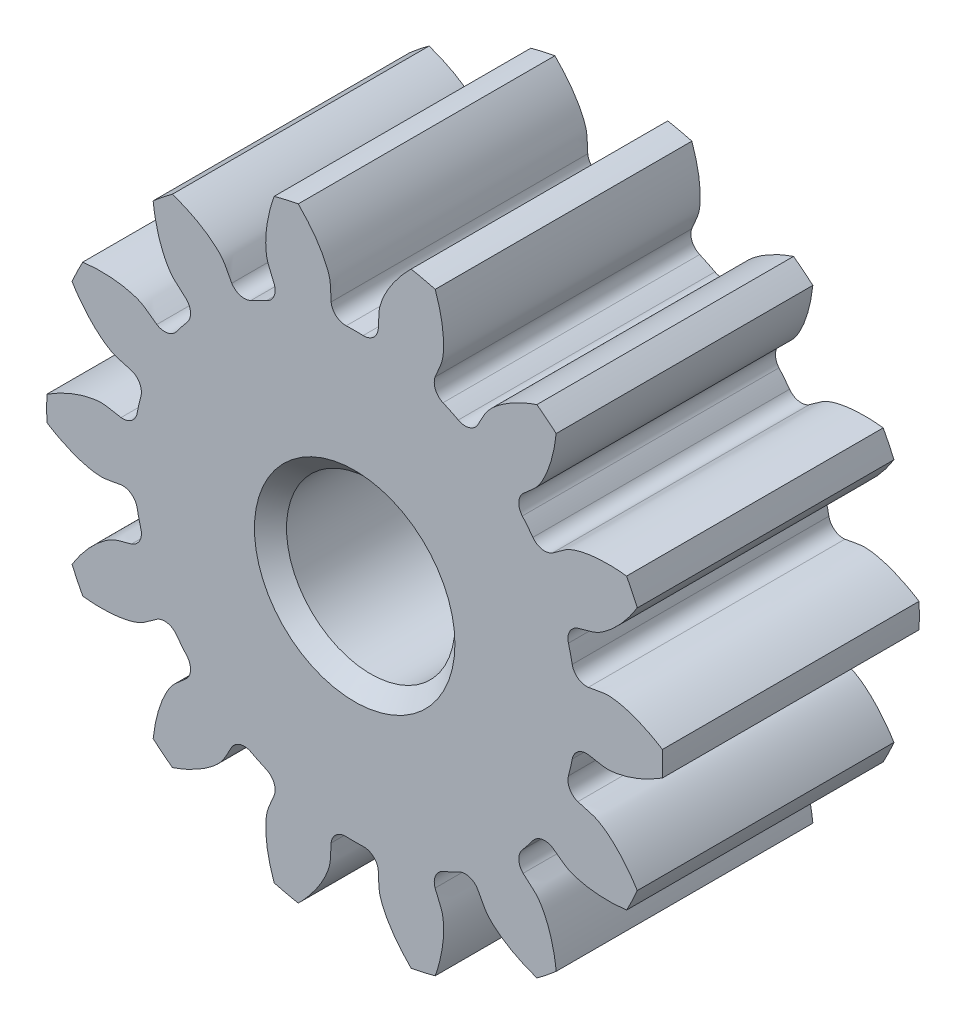
from build123d import *

# Parameters (mm, degrees)
SKETCH1_R           = 9.6
LASHENA_DEPTH       = 8
CUT_EXTRUDEA_DEPTH  = 8
WWW_KYTOOL_CN_COUNT = 14
SKETCH3_R           = 2.625
CUT_EXTRUDE2_DEPTH  = 16.659700927
CHAMFER1_SIZE       = 0.5


with BuildPart() as part:
    # Sketch1 → LaShenA (new body)
    with BuildSketch(Plane.XY):
        Circle(SKETCH1_R)
    extrude(amount=LASHENA_DEPTH)

    # SketchA → Cut-ExtrudeA (cut)
    with BuildSketch(Plane.XY.offset(8)):
        with BuildLine():
            ThreePointArc((0.26393016, 6.894950389), (0, 6.9), (-0.26393016, 6.894950389))
            ThreePointArc((-0.26393016, 6.894950389), (-0.579770413, 7.005805588), (-0.734822357, 7.302458305))
            add(Edge.make_bspline(
                [(-0.734822357, 7.302458305), (-0.754433399, 7.487112064), (-0.737569189, 7.703882298), (-0.781720243, 7.928445907), (-0.797392974, 7.985498549), (-0.811085013, 8.030575138), (-0.828493419, 8.082070174), (-0.849959168, 8.139814633), (-0.875893686, 8.203596808), (-0.906673874, 8.273194995), (-0.942675165, 8.348367366), (-0.984260087, 8.428855678), (-1.031780916, 8.514384646), (-1.085577958, 8.604662703), (-1.145979199, 8.699382364), (-1.213299565, 8.798220744), (-1.287840319, 8.90084006), (-1.369888442, 9.006888177), (-1.459716048, 9.11599916), (-1.557579813, 9.227793861), (-1.663720428, 9.341880521), (-1.778362068, 9.457855399), (-1.90171193, 9.575303407), (-2.033959602, 9.693798799), (-2.226077653, 9.855722018), (-2.3785632, 9.972613701), (-2.48435509, 10.048922054)],
                knots=[0.117633248, 0.117633248, 0.117633248, 0.117633248, 0.261739633, 0.285267442, 0.295625886, 0.307867683, 0.321992833, 0.338001336, 0.355893192, 0.375668402, 0.397326964, 0.42086888, 0.446294149, 0.473602771, 0.502794746, 0.533870075, 0.566828756, 0.601670791, 0.638396179, 0.677004921, 0.717497015, 0.759872463, 0.804131264, 0.850273418, 0.898298926, 1, 1, 1, 1], degree=3))
            ThreePointArc((-2.48435509, 10.048922054), (0, 10.351466304), (2.48435509, 10.048922054))
            add(Edge.make_bspline(
                [(0.734822357, 7.302458305), (0.754433399, 7.487112064), (0.737569189, 7.703882298), (0.781720243, 7.928445907), (0.797392974, 7.985498549), (0.811085013, 8.030575138), (0.828493419, 8.082070174), (0.849959168, 8.139814633), (0.875893686, 8.203596808), (0.906673874, 8.273194995), (0.942675165, 8.348367366), (0.984260087, 8.428855678), (1.031780916, 8.514384646), (1.085577958, 8.604662703), (1.145979199, 8.699382364), (1.213299565, 8.798220744), (1.287840319, 8.90084006), (1.369888442, 9.006888177), (1.459716048, 9.11599916), (1.557579813, 9.227793861), (1.663720428, 9.341880521), (1.778362068, 9.457855399), (1.90171193, 9.575303407), (2.033959602, 9.693798799), (2.226077653, 9.855722018), (2.3785632, 9.972613701), (2.48435509, 10.048922054)],
                knots=[0.117633248, 0.117633248, 0.117633248, 0.117633248, 0.261739633, 0.285267442, 0.295625886, 0.307867683, 0.321992833, 0.338001336, 0.355893192, 0.375668402, 0.397326964, 0.42086888, 0.446294149, 0.473602771, 0.502794746, 0.533870075, 0.566828756, 0.601670791, 0.638396179, 0.677004921, 0.717497015, 0.759872463, 0.804131264, 0.850273418, 0.898298926, 1, 1, 1, 1], degree=3))
            ThreePointArc((0.734822357, 7.302458305), (0.579770413, 7.005805588), (0.26393016, 6.894950389))
        make_face()
    cut_extrudea = extrude(amount=-CUT_EXTRUDEA_DEPTH, mode=Mode.SUBTRACT)

    # www.KYTool.cn: Cut-ExtrudeA ×14 about axis
    www_kytool_cn_axis = Axis((0, 0, -88.99), (0, 0, 1))
    for i in range(1, WWW_KYTOOL_CN_COUNT):
        add(cut_extrudea.rotate(www_kytool_cn_axis, i * 360 / WWW_KYTOOL_CN_COUNT), mode=Mode.SUBTRACT)

    # Sketch3 → Cut-Extrude2 (cut, through all)
    with BuildSketch(Plane.XY.offset(8)):
        Circle(SKETCH3_R)
    extrude(amount=-CUT_EXTRUDE2_DEPTH, mode=Mode.SUBTRACT)

    # Chamfer1
    chamfer1_edges = [part.edges().sort_by_distance(p)[0] for p in [
        (-2.625, 0, 0),
        (-2.625, 0, 8),
    ]]
    chamfer(chamfer1_edges, length=CHAMFER1_SIZE)


solid = part.part
